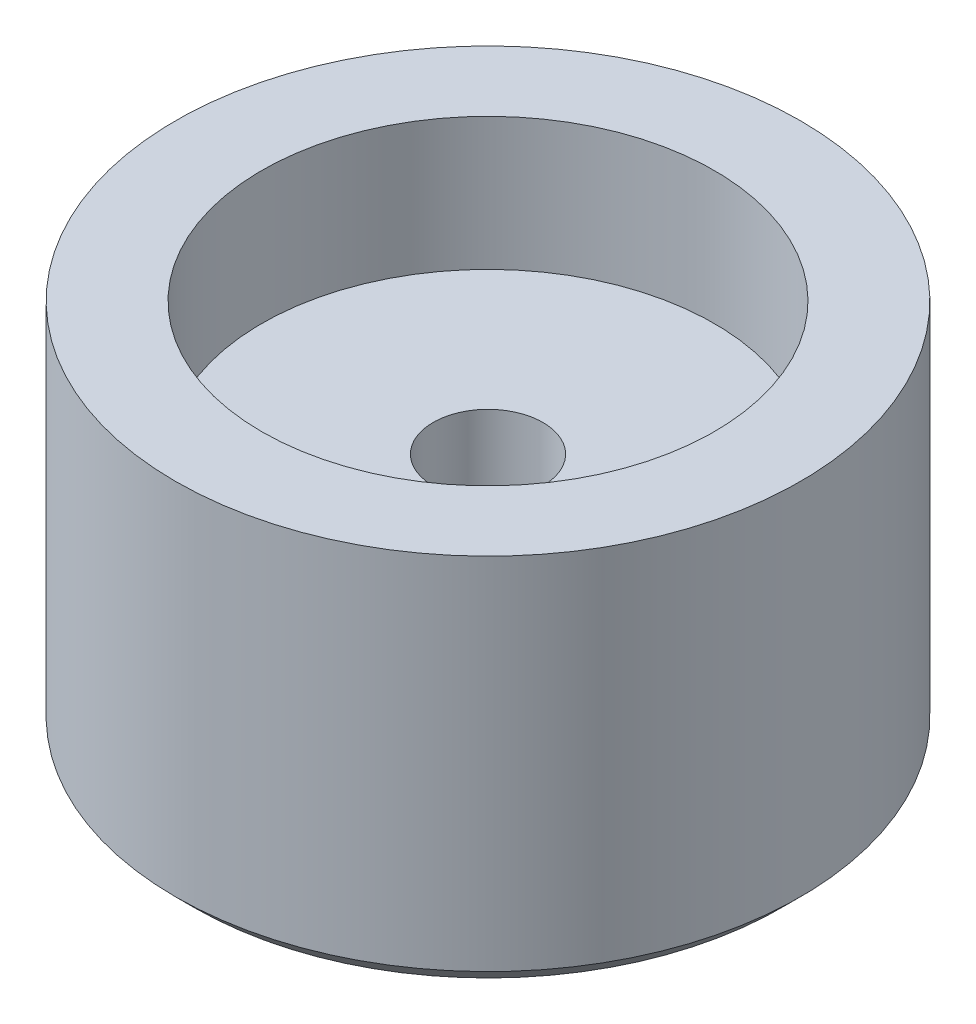
from build123d import *

# Parameters (mm, degrees)
SKETCH1_R           = 8.25
SKETCH1_R_2         = 1.45
BOSS_EXTRUDE1_DEPTH = 10
SKETCH2_R           = 5.975
CUT_EXTRUDE1_DEPTH  = 3.5
CHAMFER1_SIZE       = 0.5


with BuildPart() as part:
    # Sketch1 → Boss-Extrude1 (new body)
    with BuildSketch(Plane(origin=(0, 0, 0), x_dir=(1, 0, 0), z_dir=(0, 1, 0))):
        with Locations(Location((0, 0, 0), (0, 0, 270))):
            Circle(SKETCH1_R)
        with Locations(Location((0, 0, 0), (0, 0, 270))):
            Circle(SKETCH1_R_2, mode=Mode.SUBTRACT)
    extrude(amount=BOSS_EXTRUDE1_DEPTH)

    # Sketch2 → Cut-Extrude1 (cut)
    with BuildSketch(Plane(origin=(0, 10, 0), x_dir=(1, 0, 0), z_dir=(0, 1, 0))):
        with Locations(Location((0, 0, 0), (0, 0, 270))):
            Circle(SKETCH2_R)
    extrude(amount=-CUT_EXTRUDE1_DEPTH, mode=Mode.SUBTRACT)

    # Chamfer1
    chamfer1_edges = [part.edges().sort_by_distance(p)[0] for p in [
        (0, 0, -8.25),
    ]]
    chamfer(chamfer1_edges, length=CHAMFER1_SIZE)


solid = part.part
